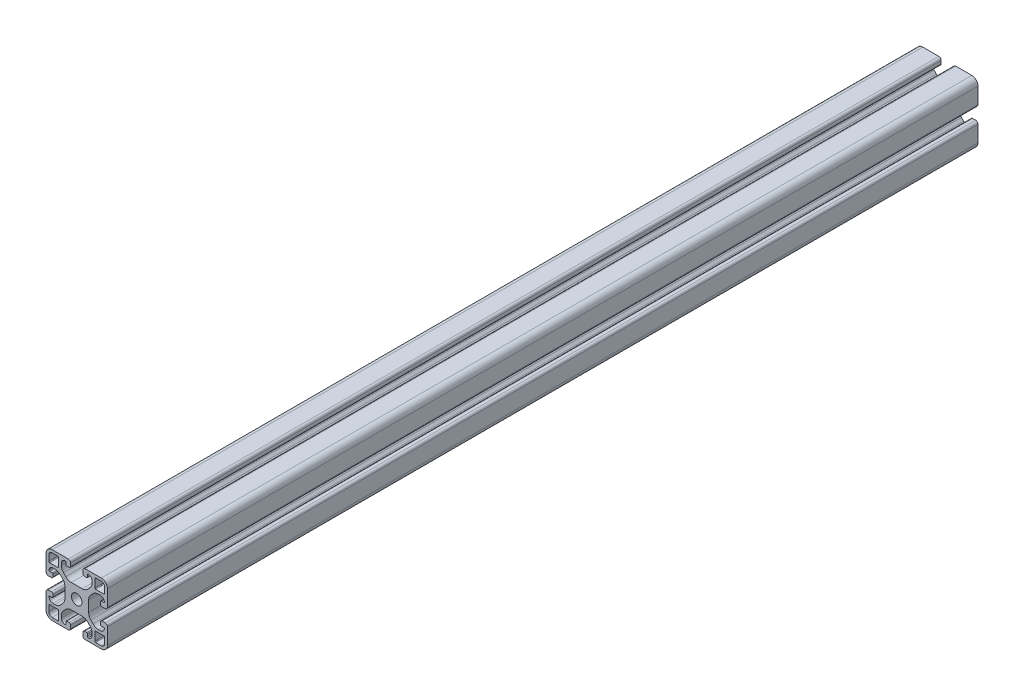
from build123d import *

# Parameters (mm, degrees)
ESQUISSE1_R        = 3.4
BOSS_EXTRU_1_DEPTH = 567


with BuildPart() as part:
    # Esquisse1 → Boss.-Extru.1 (new body)
    with BuildSketch(Plane(origin=(0, 0, -30), x_dir=(-1, 0, 0), z_dir=(0, 0, -1))):
        with BuildLine():
            Line((-4.5, 15), (-4.5, 13.5))
            ThreePointArc((-4.5, 13.5), (-4.353553391, 13.146446609), (-4, 13))
            Line((-4, 13), (-2.5, 13))
            ThreePointArc((-2.5, 13), (-2.146446609, 12.853553391), (-2, 12.5))
            ThreePointArc((-2, 12.5), (-2.732233047, 10.732233047), (-4.5, 10))
            Line((-4.5, 10), (-5.807611845, 10))
            ThreePointArc((-5.807611845, 10), (-7.721029006, 10.380602337), (-9.343145751, 11.464466094))
            Line((-9.343145751, 11.464466094), (-10.785533906, 12.906854249))
            ThreePointArc((-10.785533906, 12.906854249), (-11.869397663, 14.528970994), (-12.25, 16.442388155))
            Line((-12.25, 16.442388155), (-12.25, 23.557611845))
            ThreePointArc((-12.25, 23.557611845), (-11.869397663, 25.471029006), (-10.785533906, 27.093145751))
            Line((-10.785533906, 27.093145751), (-9.343145751, 28.535533906))
            ThreePointArc((-9.343145751, 28.535533906), (-7.721029006, 29.619397663), (-5.807611845, 30))
            Line((-5.807611845, 30), (-4.5, 30))
            ThreePointArc((-4.5, 30), (-2.732233047, 29.267766953), (-2, 27.5))
            ThreePointArc((-2, 27.5), (-2.146446609, 27.146446609), (-2.5, 27))
            Line((-2.5, 27), (-4, 27))
            ThreePointArc((-4, 27), (-4.353553391, 26.853553391), (-4.5, 26.5))
            Line((-4.5, 26.5), (-4.5, 25))
            ThreePointArc((-4.5, 25), (-4.207106781, 24.292893219), (-3.5, 24))
            Line((-3.5, 24), (-1.5, 24))
            ThreePointArc((-1.5, 24), (-0.439339828, 24.439339828), (0, 25.5))
            Line((0, 25.5), (0, 36))
            ThreePointArc((0, 36), (-1.171572875, 38.828427125), (-4, 40))
            Line((-4, 40), (-14.5, 40))
            ThreePointArc((-14.5, 40), (-15.560660172, 39.560660172), (-16, 38.5))
            Line((-16, 38.5), (-16, 36.5))
            ThreePointArc((-16, 36.5), (-15.707106781, 35.792893219), (-15, 35.5))
            Line((-15, 35.5), (-13.5, 35.5))
            ThreePointArc((-13.5, 35.5), (-13.146446609, 35.646446609), (-13, 36))
            Line((-13, 36), (-13, 37.5))
            ThreePointArc((-13, 37.5), (-12.853553391, 37.853553391), (-12.5, 38))
            ThreePointArc((-12.5, 38), (-10.732233047, 37.267766953), (-10, 35.5))
            Line((-10, 35.5), (-10, 34.192388155))
            ThreePointArc((-10, 34.192388155), (-10.380602337, 32.278970994), (-11.464466094, 30.656854249))
            Line((-11.464466094, 30.656854249), (-12.906854249, 29.214466094))
            ThreePointArc((-12.906854249, 29.214466094), (-14.528970994, 28.130602337), (-16.442388155, 27.75))
            Line((-16.442388155, 27.75), (-23.557611845, 27.75))
            ThreePointArc((-23.557611845, 27.75), (-25.471029006, 28.130602337), (-27.093145751, 29.214466094))
            Line((-27.093145751, 29.214466094), (-28.535533906, 30.656854249))
            ThreePointArc((-28.535533906, 30.656854249), (-29.619397663, 32.278970994), (-30, 34.192388155))
            Line((-30, 34.192388155), (-30, 35.5))
            ThreePointArc((-30, 35.5), (-29.267766953, 37.267766953), (-27.5, 38))
            ThreePointArc((-27.5, 38), (-27.146446609, 37.853553391), (-27, 37.5))
            Line((-27, 37.5), (-27, 36))
            ThreePointArc((-27, 36), (-26.853553391, 35.646446609), (-26.5, 35.5))
            Line((-26.5, 35.5), (-25, 35.5))
            ThreePointArc((-25, 35.5), (-24.292893219, 35.792893219), (-24, 36.5))
            Line((-24, 36.5), (-24, 38.5))
            ThreePointArc((-24, 38.5), (-24.439339828, 39.560660172), (-25.5, 40))
            Line((-25.5, 40), (-36, 40))
            ThreePointArc((-36, 40), (-38.828427125, 38.828427125), (-40, 36))
            Line((-40, 36), (-40, 25.5))
            ThreePointArc((-40, 25.5), (-39.560660172, 24.439339828), (-38.5, 24))
            Line((-38.5, 24), (-36.5, 24))
            ThreePointArc((-36.5, 24), (-35.792893219, 24.292893219), (-35.5, 25))
            Line((-35.5, 25), (-35.5, 26.5))
            ThreePointArc((-35.5, 26.5), (-35.646446609, 26.853553391), (-36, 27))
            Line((-36, 27), (-37.5, 27))
            ThreePointArc((-37.5, 27), (-37.853553391, 27.146446609), (-38, 27.5))
            ThreePointArc((-38, 27.5), (-37.267766953, 29.267766953), (-35.5, 30))
            Line((-35.5, 30), (-34.192388155, 30))
            ThreePointArc((-34.192388155, 30), (-32.278970994, 29.619397663), (-30.656854249, 28.535533906))
            Line((-30.656854249, 28.535533906), (-29.214466094, 27.093145751))
            ThreePointArc((-29.214466094, 27.093145751), (-28.130602337, 25.471029006), (-27.75, 23.557611845))
            Line((-27.75, 23.557611845), (-27.75, 16.442388155))
            ThreePointArc((-27.75, 16.442388155), (-28.130602337, 14.528970994), (-29.214466094, 12.906854249))
            Line((-29.214466094, 12.906854249), (-30.656854249, 11.464466094))
            ThreePointArc((-30.656854249, 11.464466094), (-32.278970994, 10.380602337), (-34.192388155, 10))
            Line((-34.192388155, 10), (-35.5, 10))
            ThreePointArc((-35.5, 10), (-37.267766953, 10.732233047), (-38, 12.5))
            ThreePointArc((-38, 12.5), (-37.853553391, 12.853553391), (-37.5, 13))
            Line((-37.5, 13), (-36, 13))
            ThreePointArc((-36, 13), (-35.646446609, 13.146446609), (-35.5, 13.5))
            Line((-35.5, 13.5), (-35.5, 15))
            ThreePointArc((-35.5, 15), (-35.792893219, 15.707106781), (-36.5, 16))
            Line((-36.5, 16), (-38.5, 16))
            ThreePointArc((-38.5, 16), (-39.560660172, 15.560660172), (-40, 14.5))
            Line((-40, 14.5), (-40, 4))
            ThreePointArc((-40, 4), (-38.828427125, 1.171572875), (-36, 0))
            Line((-36, 0), (-25.5, 0))
            ThreePointArc((-25.5, 0), (-24.439339828, 0.439339828), (-24, 1.5))
            Line((-24, 1.5), (-24, 3.5))
            ThreePointArc((-24, 3.5), (-24.292893219, 4.207106781), (-25, 4.5))
            Line((-25, 4.5), (-26.5, 4.5))
            ThreePointArc((-26.5, 4.5), (-26.853553391, 4.353553391), (-27, 4))
            Line((-27, 4), (-27, 2.5))
            ThreePointArc((-27, 2.5), (-27.146446609, 2.146446609), (-27.5, 2))
            ThreePointArc((-27.5, 2), (-29.267766953, 2.732233047), (-30, 4.5))
            Line((-30, 4.5), (-30, 5.807611845))
            ThreePointArc((-30, 5.807611845), (-29.619397663, 7.721029006), (-28.535533906, 9.343145751))
            Line((-28.535533906, 9.343145751), (-27.093145751, 10.785533906))
            ThreePointArc((-27.093145751, 10.785533906), (-25.471029006, 11.869397663), (-23.557611845, 12.25))
            Line((-23.557611845, 12.25), (-16.442388155, 12.25))
            ThreePointArc((-16.442388155, 12.25), (-14.528970994, 11.869397663), (-12.906854249, 10.785533906))
            Line((-12.906854249, 10.785533906), (-11.464466094, 9.343145751))
            ThreePointArc((-11.464466094, 9.343145751), (-10.380602337, 7.721029006), (-10, 5.807611845))
            Line((-10, 5.807611845), (-10, 4.5))
            ThreePointArc((-10, 4.5), (-10.732233047, 2.732233047), (-12.5, 2))
            ThreePointArc((-12.5, 2), (-12.853553391, 2.146446609), (-13, 2.5))
            Line((-13, 2.5), (-13, 4))
            ThreePointArc((-13, 4), (-13.146446609, 4.353553391), (-13.5, 4.5))
            Line((-13.5, 4.5), (-15, 4.5))
            ThreePointArc((-15, 4.5), (-15.707106781, 4.207106781), (-16, 3.5))
            Line((-16, 3.5), (-16, 1.5))
            ThreePointArc((-16, 1.5), (-15.560660172, 0.439339828), (-14.5, 0))
            Line((-14.5, 0), (-4, 0))
            ThreePointArc((-4, 0), (-1.171572875, 1.171572875), (0, 4))
            Line((0, 4), (0, 14.5))
            ThreePointArc((0, 14.5), (-0.439339828, 15.560660172), (-1.5, 16))
            Line((-1.5, 16), (-3.5, 16))
            ThreePointArc((-3.5, 16), (-4.207106781, 15.707106781), (-4.5, 15))
        make_face()
        with Locations(Location((-20, 20, 0), (0, 0, 180))):
            Circle(ESQUISSE1_R, mode=Mode.SUBTRACT)
        with BuildLine():
            Line((-4, 1.8), (-7.7, 1.8))
            ThreePointArc((-7.7, 1.8), (-8.053553391, 1.946446609), (-8.2, 2.3))
            Line((-8.2, 2.3), (-8.2, 7.7))
            ThreePointArc((-8.2, 7.7), (-8.053553391, 8.053553391), (-7.7, 8.2))
            Line((-7.7, 8.2), (-2.3, 8.2))
            ThreePointArc((-2.3, 8.2), (-1.946446609, 8.053553391), (-1.8, 7.7))
            Line((-1.8, 7.7), (-1.8, 4))
            ThreePointArc((-1.8, 4), (-2.444365081, 2.444365081), (-4, 1.8))
        make_face(mode=Mode.SUBTRACT)
        with BuildLine():
            Line((-38.2, 4), (-38.2, 7.7))
            ThreePointArc((-38.2, 7.7), (-38.053553391, 8.053553391), (-37.7, 8.2))
            Line((-37.7, 8.2), (-32.3, 8.2))
            ThreePointArc((-32.3, 8.2), (-31.946446609, 8.053553391), (-31.8, 7.7))
            Line((-31.8, 7.7), (-31.8, 2.3))
            ThreePointArc((-31.8, 2.3), (-31.946446609, 1.946446609), (-32.3, 1.8))
            Line((-32.3, 1.8), (-36, 1.8))
            ThreePointArc((-36, 1.8), (-37.555634919, 2.444365081), (-38.2, 4))
        make_face(mode=Mode.SUBTRACT)
        with BuildLine():
            Line((-36, 38.2), (-32.3, 38.2))
            ThreePointArc((-32.3, 38.2), (-31.946446609, 38.053553391), (-31.8, 37.7))
            Line((-31.8, 37.7), (-31.8, 32.3))
            ThreePointArc((-31.8, 32.3), (-31.946446609, 31.946446609), (-32.3, 31.8))
            Line((-32.3, 31.8), (-37.7, 31.8))
            ThreePointArc((-37.7, 31.8), (-38.053553391, 31.946446609), (-38.2, 32.3))
            Line((-38.2, 32.3), (-38.2, 36))
            ThreePointArc((-38.2, 36), (-37.555634919, 37.555634919), (-36, 38.2))
        make_face(mode=Mode.SUBTRACT)
        with BuildLine():
            Line((-1.8, 36), (-1.8, 32.3))
            ThreePointArc((-1.8, 32.3), (-1.946446609, 31.946446609), (-2.3, 31.8))
            Line((-2.3, 31.8), (-7.7, 31.8))
            ThreePointArc((-7.7, 31.8), (-8.053553391, 31.946446609), (-8.2, 32.3))
            Line((-8.2, 32.3), (-8.2, 37.7))
            ThreePointArc((-8.2, 37.7), (-8.053553391, 38.053553391), (-7.7, 38.2))
            Line((-7.7, 38.2), (-4, 38.2))
            ThreePointArc((-4, 38.2), (-2.444365081, 37.555634919), (-1.8, 36))
        make_face(mode=Mode.SUBTRACT)
    extrude(amount=-BOSS_EXTRU_1_DEPTH)


solid = part.part
